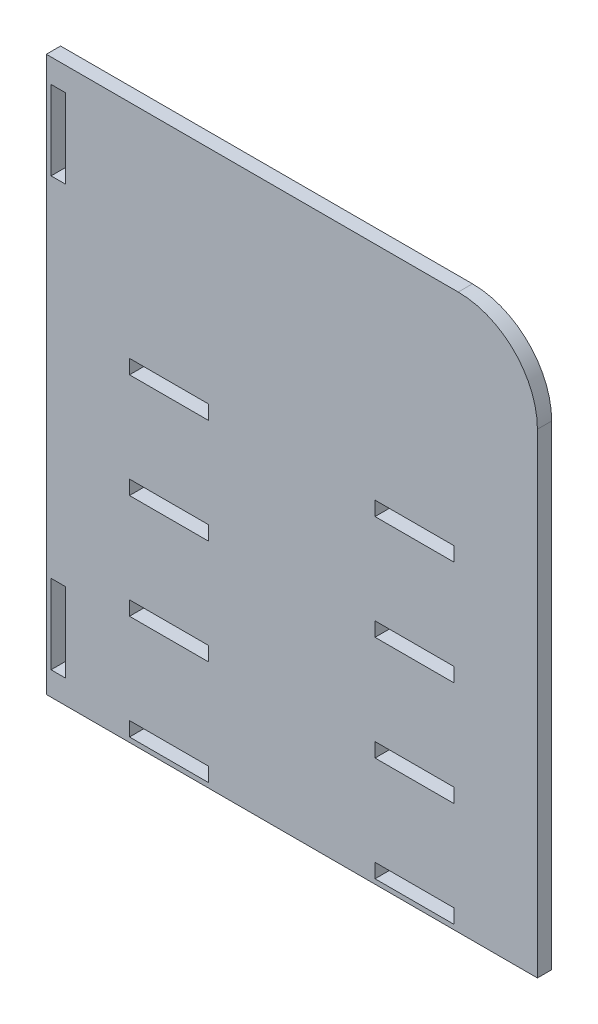
from build123d import *

# Parameters (mm, degrees)
SKETCH1_W           = 18
SKETCH1_H           = 100
SKETCH1_W_2         = 100
SKETCH1_H_2         = 18
BOSS_EXTRUDE2_DEPTH = 18


with BuildPart() as part:
    # Sketch1 → Boss-Extrude2 (new body)
    with BuildSketch(Plane.XY):
        with BuildLine():
            Line((-1197.056949538, 402.692318001), (-1817.056949538, 402.692318001))
            Line((-1817.056949538, 402.692318001), (-1817.056949538, 1102.692318001))
            Line((-1817.056949538, 1102.692318001), (-1297.056949538, 1102.692318001))
            ThreePointArc((-1297.056949538, 1102.692318001), (-1226.346271419, 1073.402996119), (-1197.056949538, 1002.692318001))
            Line((-1197.056949538, 1002.692318001), (-1197.056949538, 402.692318001))
        make_face()
        with Locations((-1802.056949538, 1022.692318001)):
            Rectangle(SKETCH1_W, SKETCH1_H, mode=Mode.SUBTRACT)
        with Locations((-1802.056949538, 482.692318001)):
            Rectangle(SKETCH1_W, SKETCH1_H, mode=Mode.SUBTRACT)
        with Locations((-1352.056949538, 417.692318001)):
            Rectangle(SKETCH1_W_2, SKETCH1_H_2, mode=Mode.SUBTRACT)
        with Locations((-1662.056949538, 417.692318001)):
            Rectangle(SKETCH1_W_2, SKETCH1_H_2, mode=Mode.SUBTRACT)
        with Locations((-1662.056949538, 549.692318001)):
            Rectangle(SKETCH1_W_2, SKETCH1_H_2, mode=Mode.SUBTRACT)
        with Locations((-1352.056949538, 549.692318001)):
            Rectangle(SKETCH1_W_2, SKETCH1_H_2, mode=Mode.SUBTRACT)
        with Locations((-1662.056949538, 681.692318001)):
            Rectangle(SKETCH1_W_2, SKETCH1_H_2, mode=Mode.SUBTRACT)
        with Locations((-1352.056949538, 681.692318001)):
            Rectangle(SKETCH1_W_2, SKETCH1_H_2, mode=Mode.SUBTRACT)
        with Locations((-1662.056949538, 813.692318001)):
            Rectangle(SKETCH1_W_2, SKETCH1_H_2, mode=Mode.SUBTRACT)
        with Locations((-1352.056949538, 813.692318001)):
            Rectangle(SKETCH1_W_2, SKETCH1_H_2, mode=Mode.SUBTRACT)
    extrude(amount=BOSS_EXTRUDE2_DEPTH)


solid = part.part
